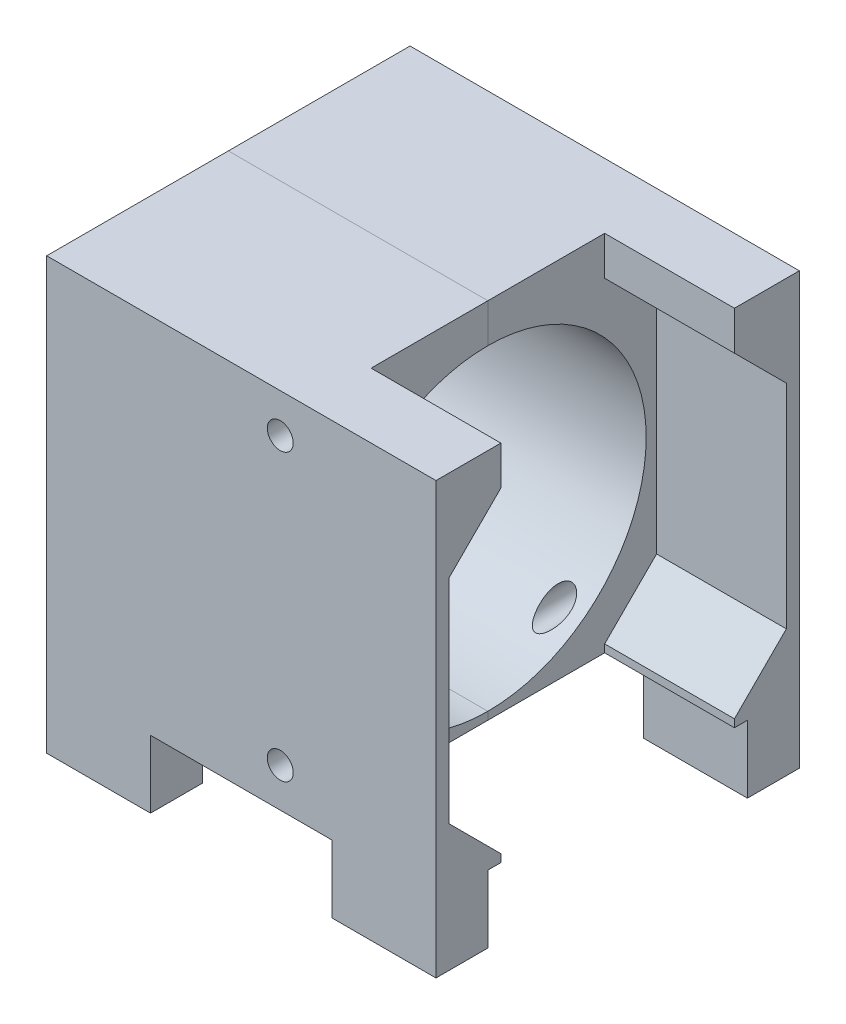
from build123d import *

# Parameters (mm, degrees)
EXTRUDE_1_DEPTH     = 20
SKETCH_2_W          = 1
SKETCH_2_H          = 24.4
EXTRUDE_2_DEPTH     = 10
EXTRUDE_4_DEPTH     = 0.6
EXTRUDE_5_DEPTH     = 10
SKETCH_8_W          = 8
SKETCH_8_H          = 4
EXTRUDE_6_DEPTH     = 5.2
EXTRUDE_7_DEPTH     = 3
SKETCH_3_R          = 1
CUT_EXTRUDE_1_DEPTH = 38.682887363
SKETCH_10_W         = 10
SKETCH_10_H         = 9
CUT_EXTRUDE_2_DEPTH = 3


with BuildPart() as part:
    # 草图1 → 凸台-拉伸1 (new body)
    with BuildSketch(Plane(origin=(0, 0, 0), x_dir=(0, 0, -1), z_dir=(1, 0, 0))):
        with BuildLine():
            Line((0, 12.2), (-14, 12.2))
            Line((-14, 12.2), (-14, -12.2))
            Line((-14, -12.2), (0, -12.2))
            ThreePointArc((0, -12.2), (-12.2, 0), (0, 12.2))
        make_face()
    extrude(amount=EXTRUDE_1_DEPTH)

    # 草图2 → 凸台-拉伸2 (add)
    with BuildSketch(Plane(origin=(20, 0, 0), x_dir=(0, 0, -1), z_dir=(1, 0, 0))):
        with Locations((-13.5, 0)):
            Rectangle(SKETCH_2_W, SKETCH_2_H)
    extrude(amount=EXTRUDE_2_DEPTH)

    # 草图6 → 凸台-拉伸4 (add)
    with BuildSketch(Plane.XZ.offset(12.2)):
        Polygon((0, 14), (0, 0), (20, 0), (20, 13), (30, 13), (30, 14), align=None)
    extrude(amount=EXTRUDE_4_DEPTH)

    # 草图7 → 凸台-拉伸5 (add)
    with BuildSketch(Plane(origin=(20, 0, 0), x_dir=(0, 0, -1), z_dir=(1, 0, 0))):
        Polygon((0, -12.2), (-9, -12.2), (-13, -8.2), (-13, -12.8), (0, -12.8), align=None)
        Polygon((-13, 8.2), (-9, 12.2), (-13, 12.2), align=None)
    extrude(amount=EXTRUDE_5_DEPTH)

    # 草图8 → 凸台-拉伸6 (add)
    with BuildSketch(Plane.XZ.offset(12.8)):
        with Locations((4, 12)):
            Rectangle(SKETCH_8_W, SKETCH_8_H)
        with Locations((26, 12)):
            Rectangle(SKETCH_8_W, SKETCH_8_H)
    extrude(amount=EXTRUDE_6_DEPTH)

    # 草图9 → 凸台-拉伸7 (add)
    with BuildSketch(Plane(origin=(0, 12.2, 0), x_dir=(1, 0, 0), z_dir=(0, 1, 0))):
        Polygon((0, 0), (20, 0), (20, -9), (30, -9), (30, -14), (0, -14), align=None)
    extrude(amount=EXTRUDE_7_DEPTH)

    # 草图3 → 切除-拉伸1 (cut, through all)
    with BuildSketch(Plane.XY.offset(14)):
        with Locations((18, 12.2)):
            Circle(SKETCH_3_R)
        with Locations((18, -9.8)):
            Circle(SKETCH_3_R)
    extrude(amount=-CUT_EXTRUDE_1_DEPTH, mode=Mode.SUBTRACT)

    # 草图10 → 切除-拉伸2 (cut)
    with BuildSketch(Plane(origin=(0, -12.2, 0), x_dir=(1, 0, 0), z_dir=(0, 1, 0))):
        with Locations((25, -4.5)):
            Rectangle(SKETCH_10_W, SKETCH_10_H)
    extrude(amount=-CUT_EXTRUDE_2_DEPTH, mode=Mode.SUBTRACT)


with BuildPart() as body_2:
    # 镜向4: mirrored copy
    add(part.part.mirror(Plane(origin=(0, 15.2, 0), x_dir=(1, 0, 0), z_dir=(0, 0, 1))))


solid = Compound([part.part, body_2.part])
